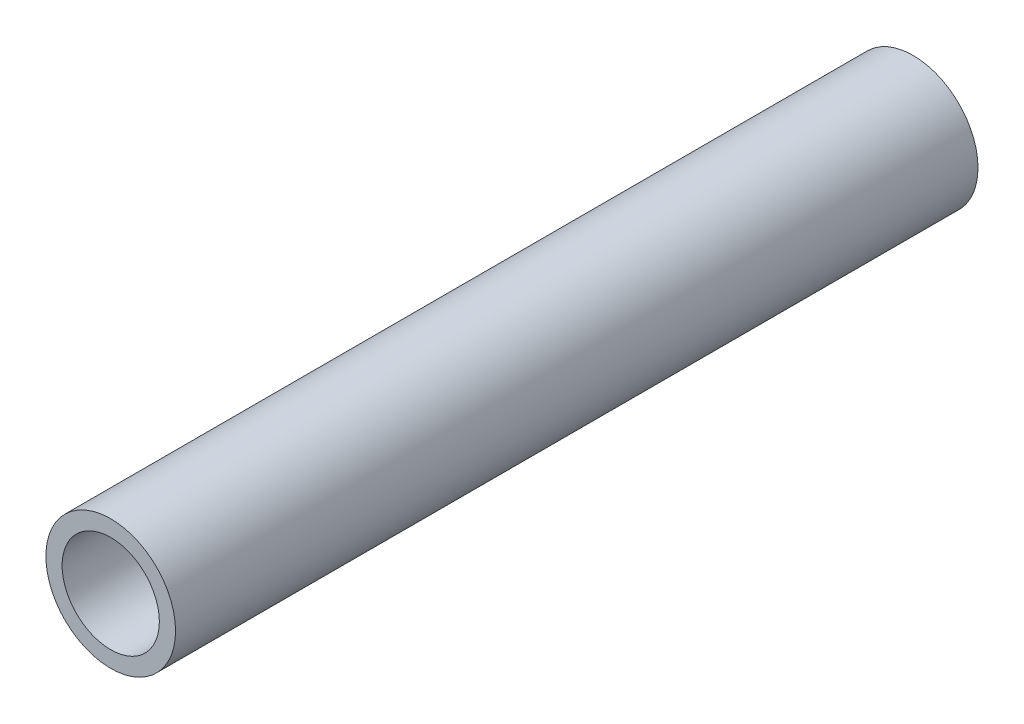
from build123d import *

# Parameters (mm, degrees)
SKETCH1_R           = 4
SKETCH1_R_2         = 3
EXTRUDE_THIN1_DEPTH = 49.5


with BuildPart() as part:
    # Sketch1 → Extrude-Thin1 (new body)
    with BuildSketch(Plane.XY):
        Circle(SKETCH1_R)
        Circle(SKETCH1_R_2, mode=Mode.SUBTRACT)
    extrude(amount=EXTRUDE_THIN1_DEPTH)


solid = part.part
